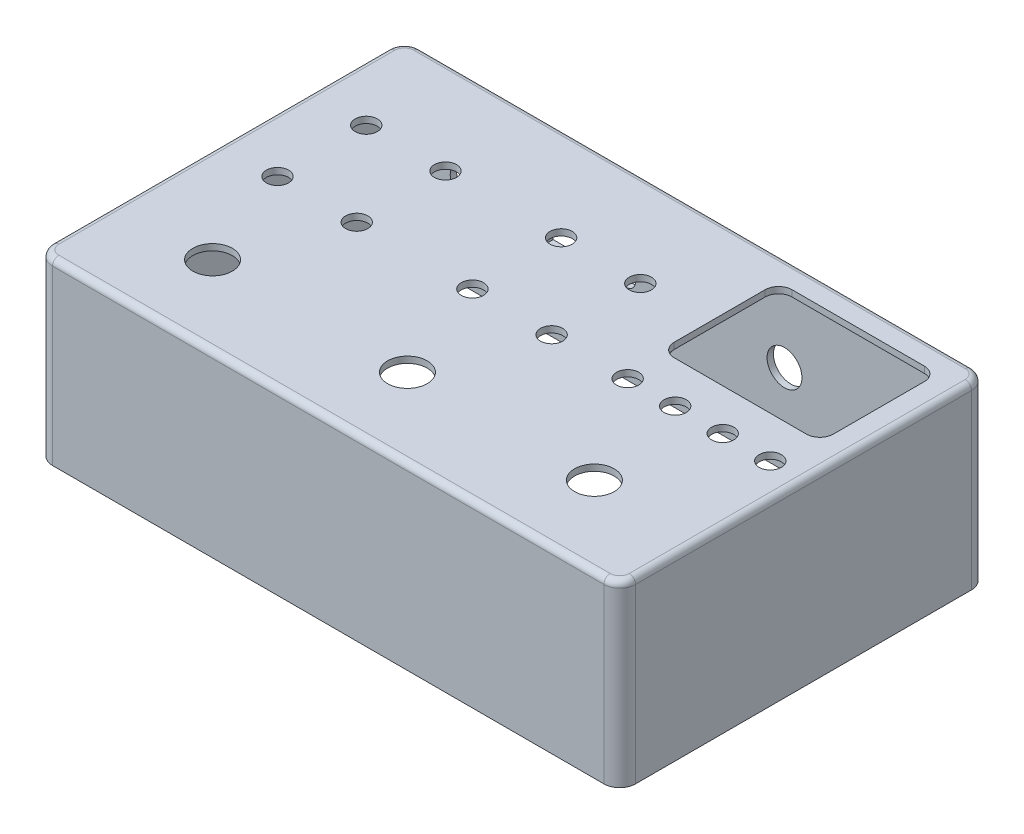
from build123d import *
from build123d.topology import SkipClean

# Parameters (mm, degrees)
SKETCH_1_W          = 184
SKETCH_1_H          = 116
SKETCH_1_R          = 3.5
SKETCH_1_R_2        = 6.25
EXTRUDE_1_DEPTH     = 56.5
SKETCH_3_W          = 178
SKETCH_3_H          = 110
CUT_EXTRUDE_2_DEPTH = 53.5
CUT_EXTRUDE_START   = -3
CUT_EXTRUDE_1_DEPTH = 3
FILLET_1_R          = 5
EXTRUDE_2_DEPTH     = 53.5
SKETCH_6_R          = 2.25
CUT_EXTRUDE_3_DEPTH = 20
FILLET_2_R          = 2
SKETCH_7_W          = 10
SKETCH_7_H          = 7
SKETCH_7_R          = 1.75
CUT_EXTRUDE_4_DEPTH = 20
CUT_EXTRUDE_START_2 = -1
CUT_EXTRUDE_5_DEPTH = 1
SKETCH_11_W         = 168
SKETCH_11_H         = 54.5
CUT_EXTRUDE_6_DEPTH = 1


with BuildPart() as part:
    # 草图1 → 凸台-拉伸1 (new body)
    with BuildSketch(Plane(origin=(0, 0, 0), x_dir=(1, 0, 0), z_dir=(0, 1, 0))):
        with Locations((-52.400171246, 0)):
            Rectangle(SKETCH_1_W, SKETCH_1_H)
        with Locations(Location((-126.400171246, 28, 0), (0, 0, 270))):
            Circle(SKETCH_1_R, mode=Mode.SUBTRACT)
        with Locations(Location((-101.400171246, 28, 0), (0, 0, 270))):
            Circle(SKETCH_1_R, mode=Mode.SUBTRACT)
        with Locations(Location((-126.400171246, 0, 0), (0, 0, 270))):
            Circle(SKETCH_1_R, mode=Mode.SUBTRACT)
        with Locations(Location((-101.400171246, 0, 0), (0, 0, 270))):
            Circle(SKETCH_1_R, mode=Mode.SUBTRACT)
        with Locations(Location((-64.900171246, 28, 0), (0, 0, 270))):
            Circle(SKETCH_1_R, mode=Mode.SUBTRACT)
        with Locations(Location((-39.900171246, 28, 0), (0, 0, 270))):
            Circle(SKETCH_1_R, mode=Mode.SUBTRACT)
        with Locations(Location((-64.900171246, 0, 0), (0, 0, 270))):
            Circle(SKETCH_1_R, mode=Mode.SUBTRACT)
        with Locations(Location((-39.900171246, 0, 0), (0, 0, 270))):
            Circle(SKETCH_1_R, mode=Mode.SUBTRACT)
        with Locations(Location((-15.900171246, 0, 0), (0, 0, 270))):
            Circle(SKETCH_1_R, mode=Mode.SUBTRACT)
        with Locations(Location((-0.900171246, 0, 0), (0, 0, 270))):
            Circle(SKETCH_1_R, mode=Mode.SUBTRACT)
        with Locations(Location((14.099828754, 0, 0), (0, 0, 270))):
            Circle(SKETCH_1_R, mode=Mode.SUBTRACT)
        with Locations(Location((29.099828754, 0, 0), (0, 0, 270))):
            Circle(SKETCH_1_R, mode=Mode.SUBTRACT)
        with Locations(Location((-113.900171246, -33, 0), (0, 0, 270))):
            Circle(SKETCH_1_R_2, mode=Mode.SUBTRACT)
        with Locations(Location((-52.400171246, -33, 0), (0, 0, 270))):
            Circle(SKETCH_1_R_2, mode=Mode.SUBTRACT)
        with Locations(Location((6.599828754, -33, 0), (0, 0, 270))):
            Circle(SKETCH_1_R_2, mode=Mode.SUBTRACT)
        with BuildLine():
            Line((-14.265171246, 50), (27.464828754, 50))
            ThreePointArc((27.464828754, 50), (30.293255879, 48.828427125), (31.464828754, 46))
            Line((31.464828754, 46), (31.464828754, 17.3))
            ThreePointArc((31.464828754, 17.3), (30.293255879, 14.471572875), (27.464828754, 13.3))
            Line((27.464828754, 13.3), (-14.265171246, 13.3))
            ThreePointArc((-14.265171246, 13.3), (-17.093598371, 14.471572875), (-18.265171246, 17.3))
            Line((-18.265171246, 17.3), (-18.265171246, 46))
            ThreePointArc((-18.265171246, 46), (-17.093598371, 48.828427125), (-14.265171246, 50))
        make_face(mode=Mode.SUBTRACT)
    extrude(amount=EXTRUDE_1_DEPTH)

    # 草图3 → 切除-拉伸2 (cut)
    with BuildSketch(Plane.XZ):
        with Locations((-52.400171246, 0)):
            Rectangle(SKETCH_3_W, SKETCH_3_H)
    extrude(amount=-CUT_EXTRUDE_2_DEPTH, mode=Mode.SUBTRACT)

    # 草图4 → 切除-拉伸-薄壁1 (cut)
    with BuildSketch(Plane(origin=(0, 56.5, 0), x_dir=(1, 0, 0), z_dir=(0, 1, 0)).offset(CUT_EXTRUDE_START)):
        with BuildLine():
            Line((31.714828754, 17.3), (31.714828754, 46))
            ThreePointArc((31.714828754, 46), (30.470032574, 49.00520382), (27.464828754, 50.25))
            Line((27.464828754, 50.25), (-14.265171246, 50.25))
            ThreePointArc((-14.265171246, 50.25), (-17.270375066, 49.00520382), (-18.515171246, 46))
            Line((-18.515171246, 46), (-18.515171246, 17.3))
            ThreePointArc((-18.515171246, 17.3), (-17.270375066, 14.29479618), (-14.265171246, 13.05))
            Line((-14.265171246, 13.05), (27.464828754, 13.05))
            ThreePointArc((27.464828754, 13.05), (30.470032574, 14.29479618), (31.714828754, 17.3))
        make_face()
        with BuildLine():
            Line((31.464828754, 17.3), (31.464828754, 46))
            ThreePointArc((31.464828754, 46), (30.293255879, 48.828427125), (27.464828754, 50))
            Line((27.464828754, 50), (-14.265171246, 50))
            ThreePointArc((-14.265171246, 50), (-17.093598371, 48.828427125), (-18.265171246, 46))
            Line((-18.265171246, 46), (-18.265171246, 17.3))
            ThreePointArc((-18.265171246, 17.3), (-17.093598371, 14.471572875), (-14.265171246, 13.3))
            Line((-14.265171246, 13.3), (27.464828754, 13.3))
            ThreePointArc((27.464828754, 13.3), (30.293255879, 14.471572875), (31.464828754, 17.3))
        make_face(mode=Mode.SUBTRACT)
    extrude(amount=CUT_EXTRUDE_1_DEPTH, mode=Mode.SUBTRACT)

    # 圆角1
    fillet_1_edges = [part.edges().sort_by_distance(p)[0] for p in [
        (36.599828754, 26.75, -55),
        (36.599828754, 26.75, 55),
        (-141.400171246, 26.75, 55),
        (-141.400171246, 26.75, -55),
        (-144.400171246, 28.25, -58),
        (39.599828754, 28.25, -58),
        (39.599828754, 28.25, 58),
        (-144.400171246, 28.25, 58),
    ]]
    fillet(fillet_1_edges, radius=FILLET_1_R)

    # 草图5 → 凸台-拉伸2 (add)
    with BuildSketch(Plane.XZ.offset(-53.5)):
        with BuildLine():
            ThreePointArc((-141.399918708, 50.050252538), (-140.25587842, 49.27322792), (-138.900171246, 49))
            Line((-138.900171246, 49), (-138.900171246, 52.5))
            Line((-138.900171246, 52.5), (-135.400171246, 52.5))
            ThreePointArc((-135.400171246, 52.5), (-135.673399166, 53.855707174), (-136.450423784, 54.999747462))
            ThreePointArc((-136.450423784, 54.999747462), (-139.935705152, 53.535533906), (-141.399918708, 50.050252538))
        make_face()
        with BuildLine():
            Line((-138.900171246, 52.5), (-138.900171246, 49))
            ThreePointArc((-138.900171246, 49), (-136.425297512, 50.025126266), (-135.400171246, 52.5))
            Line((-135.400171246, 52.5), (-138.900171246, 52.5))
        make_face()
        with BuildLine():
            Line((-135.400171246, -52.5), (-138.900171246, -52.5))
            Line((-138.900171246, -52.5), (-138.900171246, -49))
            ThreePointArc((-138.900171246, -49), (-140.25587842, -49.27322792), (-141.399918708, -50.050252538))
            ThreePointArc((-141.399918708, -50.050252538), (-139.935705152, -53.535533906), (-136.450423784, -54.999747462))
            ThreePointArc((-136.450423784, -54.999747462), (-135.673399166, -53.855707174), (-135.400171246, -52.5))
        make_face()
        with BuildLine():
            Line((-138.900171246, -49), (-138.900171246, -52.5))
            Line((-138.900171246, -52.5), (-135.400171246, -52.5))
            ThreePointArc((-135.400171246, -52.5), (-136.425297512, -50.025126266), (-138.900171246, -49))
        make_face()
        with BuildLine():
            ThreePointArc((30.599828754, 52.5), (31.62495502, 50.025126266), (34.099828754, 49))
            Line((34.099828754, 49), (34.099828754, 52.5))
            Line((34.099828754, 52.5), (30.599828754, 52.5))
        make_face()
        with BuildLine():
            Line((34.099828754, 52.5), (34.099828754, 49))
            ThreePointArc((34.099828754, 49), (35.455535928, 49.27322792), (36.599576216, 50.050252538))
            ThreePointArc((36.599576216, 50.050252538), (35.13536266, 53.535533906), (31.650081292, 54.999747462))
            ThreePointArc((31.650081292, 54.999747462), (30.873056674, 53.855707174), (30.599828754, 52.5))
            Line((30.599828754, 52.5), (34.099828754, 52.5))
        make_face()
        with BuildLine():
            ThreePointArc((34.099828754, -49), (31.62495502, -50.025126266), (30.599828754, -52.5))
            Line((30.599828754, -52.5), (34.099828754, -52.5))
            Line((34.099828754, -52.5), (34.099828754, -49))
        make_face()
        with BuildLine():
            Line((34.099828754, -52.5), (30.599828754, -52.5))
            ThreePointArc((30.599828754, -52.5), (30.873056674, -53.855707174), (31.650081292, -54.999747462))
            ThreePointArc((31.650081292, -54.999747462), (35.13536266, -53.535533906), (36.599576216, -50.050252538))
            ThreePointArc((36.599576216, -50.050252538), (35.455535928, -49.27322792), (34.099828754, -49))
            Line((34.099828754, -49), (34.099828754, -52.5))
        make_face()
    extrude(amount=EXTRUDE_2_DEPTH)

    # 草图6 → 切除-拉伸3 (cut)
    with BuildSketch(Plane.XZ):
        with Locations(Location((34.099828754, -52.5, 0), (0, 0, 270))):
            Circle(SKETCH_6_R)
        with Locations(Location((34.099828754, 52.5, 0), (0, 0, 270))):
            Circle(SKETCH_6_R)
        with Locations(Location((-138.900171246, 52.5, 0), (0, 0, 270))):
            Circle(SKETCH_6_R)
        with Locations(Location((-138.900171246, -52.5, 0), (0, 0, 270))):
            Circle(SKETCH_6_R)
    extrude(amount=-CUT_EXTRUDE_3_DEPTH, mode=Mode.SUBTRACT)

    # 圆角2
    fillet_2_edges = [part.edges().sort_by_distance(p)[0] for p in [
        (-144.400171246, 56.5, 0),
        (-52.400171246, 56.5, -58),
        (-52.400171246, 56.5, 58),
        (39.599828754, 56.5, 0),
        (38.13536266, 56.5, 56.535533906),
        (38.13536266, 56.5, -56.535533906),
        (-142.935705152, 56.5, 56.535533906),
        (-142.935705152, 56.5, -56.535533906),
    ]]
    fillet(fillet_2_edges, radius=FILLET_2_R)

    # 草图7 → 切除-拉伸4 (cut)
    with BuildSketch(Plane(origin=(0, 0, -58), x_dir=(-1, 0, 0), z_dir=(0, 0, -1))):
        with BuildLine():
            ThreePointArc((127.900171246, 28.25), (122.400171246, 33.75), (116.900171246, 28.25))
            Line((116.900171246, 28.25), (127.900171246, 28.25))
        make_face()
        with BuildLine():
            Line((127.900171246, 28.25), (116.900171246, 28.25))
            ThreePointArc((116.900171246, 28.25), (122.400171246, 22.75), (127.900171246, 28.25))
        make_face()
        with BuildLine():
            ThreePointArc((-12.099828754, 28.25), (-17.599828754, 33.75), (-23.099828754, 28.25))
            Line((-23.099828754, 28.25), (-12.099828754, 28.25))
        make_face()
        with BuildLine():
            Line((-12.099828754, 28.25), (-23.099828754, 28.25))
            ThreePointArc((-23.099828754, 28.25), (-17.599828754, 22.75), (-12.099828754, 28.25))
        make_face()
        with BuildLine():
            ThreePointArc((27.900171246, 28.25), (22.400171246, 33.75), (16.900171246, 28.25))
            Line((16.900171246, 28.25), (27.900171246, 28.25))
        make_face()
        with BuildLine():
            Line((27.900171246, 28.25), (16.900171246, 28.25))
            ThreePointArc((16.900171246, 28.25), (22.400171246, 22.75), (27.900171246, 28.25))
        make_face()
        with BuildLine():
            ThreePointArc((75.400171246, 28.25), (72.400171246, 31.25), (69.400171246, 28.25))
            Line((69.400171246, 28.25), (75.400171246, 28.25))
        make_face()
        with BuildLine():
            Line((75.400171246, 28.25), (69.400171246, 28.25))
            ThreePointArc((69.400171246, 28.25), (72.400171246, 25.25), (75.400171246, 28.25))
        make_face()
        with Locations((92.400171246, 28.25)):
            Rectangle(SKETCH_7_W, SKETCH_7_H)
        with Locations((83.900171246, 28.25)):
            Circle(SKETCH_7_R)
        with Locations((100.900171246, 28.25)):
            Circle(SKETCH_7_R)
    extrude(amount=-CUT_EXTRUDE_4_DEPTH, mode=Mode.SUBTRACT)

    # 草图10 → 切除-拉伸5 (cut)
    with SkipClean():  # the faces are left unmerged after this step: merging them gives an invalid solid
        with BuildSketch(Plane.XZ.offset(-53.5).offset(CUT_EXTRUDE_START_2)):
            with BuildLine():
                Line((36.599828754, -50), (36.599828754, 50))
                ThreePointArc((36.599828754, 50), (36.599765619, 50.025126586), (36.599576216, 50.050252538))
                ThreePointArc((36.599576216, 50.050252538), (31.62495502, 50.025126266), (31.650081292, 54.999747462))
                ThreePointArc((31.650081292, 54.999747462), (31.62495534, 54.999936865), (31.599828754, 55))
                Line((31.599828754, 55), (-136.400171246, 55))
                ThreePointArc((-136.400171246, 55), (-136.425297832, 54.999936865), (-136.450423784, 54.999747462))
                ThreePointArc((-136.450423784, 54.999747462), (-136.425297512, 50.025126266), (-141.399918708, 50.050252538))
                ThreePointArc((-141.399918708, 50.050252538), (-141.400108111, 50.025126586), (-141.400171246, 50))
                Line((-141.400171246, 50), (-141.400171246, -50))
                ThreePointArc((-141.400171246, -50), (-141.400108111, -50.025126586), (-141.399918708, -50.050252538))
                ThreePointArc((-141.399918708, -50.050252538), (-136.425297512, -50.025126266), (-136.450423784, -54.999747462))
                ThreePointArc((-136.450423784, -54.999747462), (-136.425297832, -54.999936865), (-136.400171246, -55))
                Line((-136.400171246, -55), (31.599828754, -55))
                ThreePointArc((31.599828754, -55), (31.62495534, -54.999936865), (31.650081292, -54.999747462))
                ThreePointArc((31.650081292, -54.999747462), (31.62495502, -50.025126266), (36.599576216, -50.050252538))
                ThreePointArc((36.599576216, -50.050252538), (36.599765619, -50.025126586), (36.599828754, -50))
            make_face()
        extrude(amount=CUT_EXTRUDE_5_DEPTH, mode=Mode.SUBTRACT)

    # 草图11 → 切除-拉伸6 (cut)
    with SkipClean():  # the faces are left unmerged after this step: merging them gives an invalid solid
        with BuildSketch(Plane.XY.offset(-55)):
            with Locations((-52.400171246, 27.25)):
                Rectangle(SKETCH_11_W, SKETCH_11_H)
        extrude(amount=-CUT_EXTRUDE_6_DEPTH, mode=Mode.SUBTRACT)


solid = part.part
